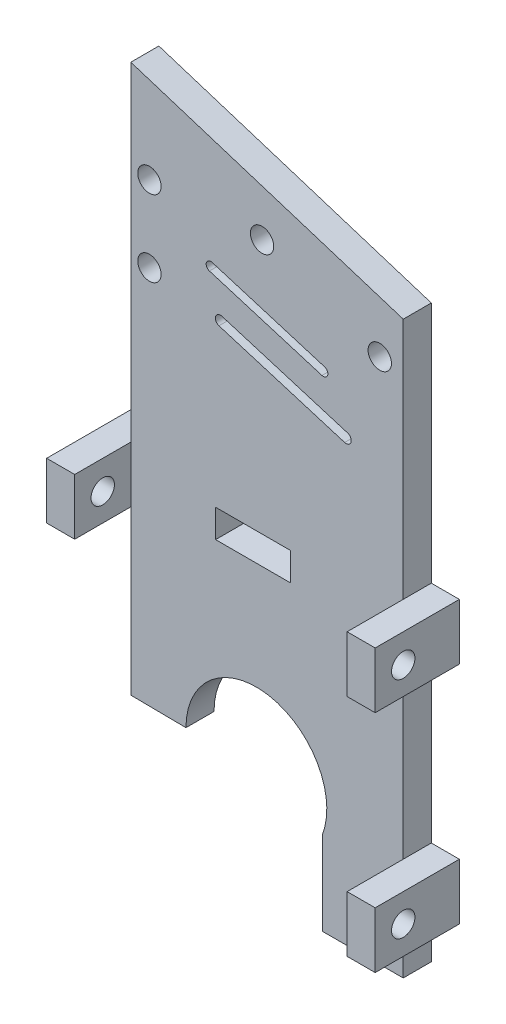
from build123d import *

# Parameters (mm, degrees)
SKETCH1_W            = 29.13
SKETCH1_H            = 2
BOSS_EXTRUDE1_DEPTH  = 45.22
SKETCH15_W           = 3.835
SKETCH15_H           = 2
BOSS_EXTRUDE7_DEPTH  = 25.02
SKETCH19_W           = 2
SKETCH19_H           = 6
BOSS_EXTRUDE9_DEPTH  = 3
SKETCH20_W           = 3
SKETCH20_H           = 6
BOSS_EXTRUDE10_DEPTH = 6
CUT_EXTRUDE10_DEPTH  = 4
SKETCH27_R           = 1.25
CUT_EXTRUDE13_DEPTH  = 5
CUT_EXTRUDE16_DEPTH  = 4.86
CUT_EXTRUDE20_DEPTH  = 5
SKETCH28_R           = 1.25
CUT_EXTRUDE23_DEPTH  = 5
SKETCH32_R           = 1.25
CUT_EXTRUDE25_DEPTH  = 5
SKETCH38_W           = 2
SKETCH38_H           = 6
BOSS_EXTRUDE11_DEPTH = 3
SKETCH39_W           = 3
SKETCH39_H           = 6
BOSS_EXTRUDE12_DEPTH = 6
SKETCH40_R           = 1.250000005
CUT_EXTRUDE26_DEPTH  = 6
SKETCH51_W           = 2
SKETCH51_H           = 6
BOSS_EXTRUDE15_DEPTH = 3
SKETCH52_W           = 3
SKETCH52_H           = 6
BOSS_EXTRUDE16_DEPTH = 6
SKETCH53_R           = 1.249999995
CUT_EXTRUDE28_DEPTH  = 6
SKETCH54_R           = 1.25
CUT_EXTRUDE29_DEPTH  = 3
CUT_EXTRUDE30_DEPTH  = 10
BOSS_EXTRUDE17_DEPTH = 3
SKETCH57_R           = 1.25
BOSS_EXTRUDE18_DEPTH = 1
SKETCH58_W           = 8
SKETCH58_H           = 3
CUT_EXTRUDE31_DEPTH  = 10


with BuildPart() as part:
    # Sketch1 → Boss-Extrude1 (new body)
    with BuildSketch(Plane(origin=(0, 0, 0), x_dir=(1, 0, 0), z_dir=(0, 1, 0))):
        with Locations((-35.580481579, -22.688974349)):
            Rectangle(SKETCH1_W, SKETCH1_H)
    extrude(amount=BOSS_EXTRUDE1_DEPTH)

    # Sketch15 → Boss-Extrude7 (add)
    with BuildSketch(Plane.XZ):
        with Locations((-22.932981579, 22.688974349)):
            Rectangle(SKETCH15_W, SKETCH15_H)
    extrude(amount=BOSS_EXTRUDE7_DEPTH)

    # Sketch19 → Boss-Extrude9 (add)
    with BuildSketch(Plane(origin=(-21.015481579, 0, 0), x_dir=(0, 0, -1), z_dir=(1, 0, 0))):
        with Locations((-22.688974349, -17.02)):
            Rectangle(SKETCH19_W, SKETCH19_H)
    extrude(amount=BOSS_EXTRUDE9_DEPTH)

    # Sketch20 → Boss-Extrude10 (add)
    with BuildSketch(Plane(origin=(0, 0, 21.688974349), x_dir=(-1, 0, 0), z_dir=(0, 0, -1))):
        with Locations((19.515481579, -17.02)):
            Rectangle(SKETCH20_W, SKETCH20_H)
    extrude(amount=BOSS_EXTRUDE10_DEPTH)

    # Sketch24 → Cut-Extrude10 (cut)
    with BuildSketch(Plane.XY.offset(23.688974349)):
        Polygon((-21.015481579, 45.22), (-21.015481579, 37.57), (-50.145481579, 45.22), align=None)
    extrude(amount=-CUT_EXTRUDE10_DEPTH, mode=Mode.SUBTRACT)

    # Sketch27 → Cut-Extrude13 (cut)
    with BuildSketch(Plane.XY.offset(23.688974349)):
        with Locations((-48.155481573, 35.325814089)):
            Circle(SKETCH27_R)
        with Locations((-48.155481573, 27.181192799)):
            Circle(SKETCH27_R)
    extrude(amount=-CUT_EXTRUDE13_DEPTH, mode=Mode.SUBTRACT)

    # Sketch35 → Cut-Extrude16 (cut)
    with BuildSketch(Plane.XY.offset(23.688974349)):
        Polygon((-21.015481579, 35.99), (-21.015481579, 37.57), (-50.145481579, 45.22), align=None)
    extrude(amount=-CUT_EXTRUDE16_DEPTH, mode=Mode.SUBTRACT)


with BuildPart() as body_2:
    # Mirror1: mirrored copy
    add(part.part.mirror(Plane(origin=(0, 0, 15.688974349), x_dir=(1, 0, 0), z_dir=(0, 0, -1))))

    # Sketch37 → Cut-Extrude20 (cut)
    with BuildSketch(Plane(origin=(0, 0, 7.688974349), x_dir=(-1, 0, 0), z_dir=(0, 0, -1))):
        with BuildLine():
            Line((29.422391304, 27.369440111), (41.452993211, 31.026802565))
            ThreePointArc((41.452993211, 31.026802565), (42.065476612, 30.699897808), (41.738571855, 30.087414406))
            Line((41.738571855, 30.087414406), (29.707969948, 26.430051952))
            ThreePointArc((29.707969948, 26.430051952), (29.095486546, 26.75695671), (29.422391304, 27.369440111))
        make_face()
        with BuildLine():
            Line((26.963881394, 22.478846245), (40.405895564, 26.565285004))
            ThreePointArc((40.405895564, 26.565285004), (41.083801623, 26.203461785), (40.721978404, 25.525555725))
            Line((40.721978404, 25.525555725), (27.279964235, 21.439116966))
            ThreePointArc((27.279964235, 21.439116966), (26.602058175, 21.800940185), (26.963881394, 22.478846245))
        make_face()
    extrude(amount=-CUT_EXTRUDE20_DEPTH, mode=Mode.SUBTRACT)


with BuildPart() as body_2_2:
    # Mirror2: mirrored copy
    add(body_2.part.mirror(Plane.XY.offset(15.688974349)))

    # Sketch28 → Cut-Extrude23 (cut)
    with BuildSketch(Plane.XY.offset(23.688974349)):
        with Locations((-23.525481526, 31.253503444)):
            Circle(SKETCH28_R)
    extrude(amount=-CUT_EXTRUDE23_DEPTH, mode=Mode.SUBTRACT)

    # Sketch32 → Cut-Extrude25 (cut)
    with BuildSketch(Plane.XY.offset(23.688974349)):
        with Locations((-36.114456484, 35.789812978)):
            Circle(SKETCH32_R)
    extrude(amount=-CUT_EXTRUDE25_DEPTH, mode=Mode.SUBTRACT)

    # Sketch38 → Boss-Extrude11 (add)
    with BuildSketch(Plane.ZY.offset(50.145481579)):
        with Locations((22.688974349, 7.042669101)):
            Rectangle(SKETCH38_W, SKETCH38_H)
    extrude(amount=BOSS_EXTRUDE11_DEPTH)

    # Sketch39 → Boss-Extrude12 (add)
    with BuildSketch(Plane(origin=(0, 0, 21.688974349), x_dir=(-1, 0, 0), z_dir=(0, 0, -1))):
        with Locations((51.645481579, 7.042669101)):
            Rectangle(SKETCH39_W, SKETCH39_H)
    extrude(amount=BOSS_EXTRUDE12_DEPTH)

    # Sketch40 → Cut-Extrude26 (cut)
    with BuildSketch(Plane.ZY.offset(53.145481579)):
        with Locations((18.688974344, 6.98)):
            Circle(SKETCH40_R)
    extrude(amount=-CUT_EXTRUDE26_DEPTH, mode=Mode.SUBTRACT)

    # Sketch51 → Boss-Extrude15 (add)
    with BuildSketch(Plane(origin=(-21.015481579, 0, 0), x_dir=(0, 0, -1), z_dir=(1, 0, 0))):
        with Locations((-22.688974349, 7.042669101)):
            Rectangle(SKETCH51_W, SKETCH51_H)
    extrude(amount=BOSS_EXTRUDE15_DEPTH)

    # Sketch52 → Boss-Extrude16 (add)
    with BuildSketch(Plane(origin=(0, 0, 21.688974349), x_dir=(-1, 0, 0), z_dir=(0, 0, -1))):
        with Locations((19.515481579, 7.042669101)):
            Rectangle(SKETCH52_W, SKETCH52_H)
    extrude(amount=BOSS_EXTRUDE16_DEPTH)

    # Sketch53 → Cut-Extrude28 (cut)
    with BuildSketch(Plane(origin=(-18.015481579, 0, 0), x_dir=(0, 0, -1), z_dir=(1, 0, 0))):
        with Locations(Location((-18.688974344, 6.98, 0), (0, 0, 180))):
            Circle(SKETCH53_R)
    extrude(amount=-CUT_EXTRUDE28_DEPTH, mode=Mode.SUBTRACT)


with BuildPart() as body_2_3:
    # Mirror4: mirrored copy
    add(body_2_2.part.mirror(Plane(origin=(0, 0, 15.688974349), x_dir=(1, 0, 0), z_dir=(0, 0, -1))))

    # Sketch54 → Cut-Extrude29 (cut)
    with BuildSketch(Plane(origin=(-18.015481579, 0, 0), x_dir=(0, 0, -1), z_dir=(1, 0, 0))):
        with Locations((-12.688974354, -17.012020694)):
            Circle(SKETCH54_R)
    extrude(amount=-CUT_EXTRUDE29_DEPTH, mode=Mode.SUBTRACT)

    # Sketch55 → Cut-Extrude30 (cut)
    with BuildSketch(Plane(origin=(0, 0, 7.688974349), x_dir=(-1, 0, 0), z_dir=(0, 0, -1))):
        Polygon((24.850481579, 0), (21.015481579, -25.02), (24.850481579, -25.02), align=None)
    extrude(amount=-CUT_EXTRUDE30_DEPTH, mode=Mode.SUBTRACT)

    # Sketch56 → Boss-Extrude17 (add)
    with BuildSketch(Plane.XY.offset(9.688974349)):
        with BuildLine():
            Line((-21.015481579, -25.02), (-24.850481579, 0))
            Line((-24.850481579, 0), (-50.145481579, 0))
            Line((-50.145481579, 0), (-50.145481579, -13.39301212))
            Line((-50.145481579, -13.39301212), (-44.248800379, -13.458826151))
            ThreePointArc((-44.248800379, -13.458826151), (-35.383312942, -6.047023199), (-29.659784654, -16.085594533))
            Line((-29.659784654, -16.085594533), (-29.659784654, -25.02))
            Line((-29.659784654, -25.02), (-21.015481579, -25.02))
        make_face()
    extrude(amount=-BOSS_EXTRUDE17_DEPTH)

    # Sketch57 → Boss-Extrude18 (add)
    with BuildSketch(Plane(origin=(0, 0, 7.688974349), x_dir=(-1, 0, 0), z_dir=(0, 0, -1))):
        Polygon((21.015481579, -25.02), (21.015481579, -20.02), (18.015481579, -20.02), (18.015481579, -14.02), (21.015481579, -14.02), (21.015481579, 4.042669101), (18.015481579, 4.042669101), (18.015481579, 10.042669101), (21.015481579, 10.042669101), (21.015481579, 35.99), (50.145481579, 45.22), (50.145481579, 10.042669101), (53.145481579, 10.042669101), (53.145481579, 4.042669101), (50.145481579, 4.042669101), (50.145481579, 0), (24.850481579, 0), align=None)
        with Locations(Location((23.525481526, 31.253503444, 0), (0, 0, 180))):
            Circle(SKETCH57_R, mode=Mode.SUBTRACT)
        with Locations(Location((36.114456484, 35.789812978, 0), (0, 0, 180))):
            Circle(SKETCH57_R, mode=Mode.SUBTRACT)
        with Locations(Location((48.155481573, 35.325814089, 0), (0, 0, 180))):
            Circle(SKETCH57_R, mode=Mode.SUBTRACT)
        with Locations(Location((48.155481573, 27.181192799, 0), (0, 0, 180))):
            Circle(SKETCH57_R, mode=Mode.SUBTRACT)
        with BuildLine():
            Line((29.422855642, 27.367912705), (41.45345755, 31.025275159))
            ThreePointArc((41.45345755, 31.025275159), (42.063949206, 30.699433469), (41.738107516, 30.088941812))
            Line((41.738107516, 30.088941812), (29.707505609, 26.431579358))
            ThreePointArc((29.707505609, 26.431579358), (29.097013952, 26.757421048), (29.422855642, 27.367912705))
        make_face(mode=Mode.SUBTRACT)
        with BuildLine():
            Line((26.964038287, 22.478330158), (40.406052456, 26.564768917))
            ThreePointArc((40.406052456, 26.564768917), (41.083285536, 26.203304892), (40.721821511, 25.526071812))
            Line((40.721821511, 25.526071812), (27.279807342, 21.439633053))
            ThreePointArc((27.279807342, 21.439633053), (26.602574262, 21.801097078), (26.964038287, 22.478330158))
        make_face(mode=Mode.SUBTRACT)
    extrude(amount=BOSS_EXTRUDE18_DEPTH)

    # Sketch58 → Cut-Extrude31 (cut)
    with BuildSketch(Plane(origin=(0, 0, 6.688974349), x_dir=(-1, 0, 0), z_dir=(0, 0, -1))):
        with Locations((37.080481579, 7.042669101)):
            Rectangle(SKETCH58_W, SKETCH58_H)
    extrude(amount=-CUT_EXTRUDE31_DEPTH, mode=Mode.SUBTRACT)


solid = body_2_3.part
